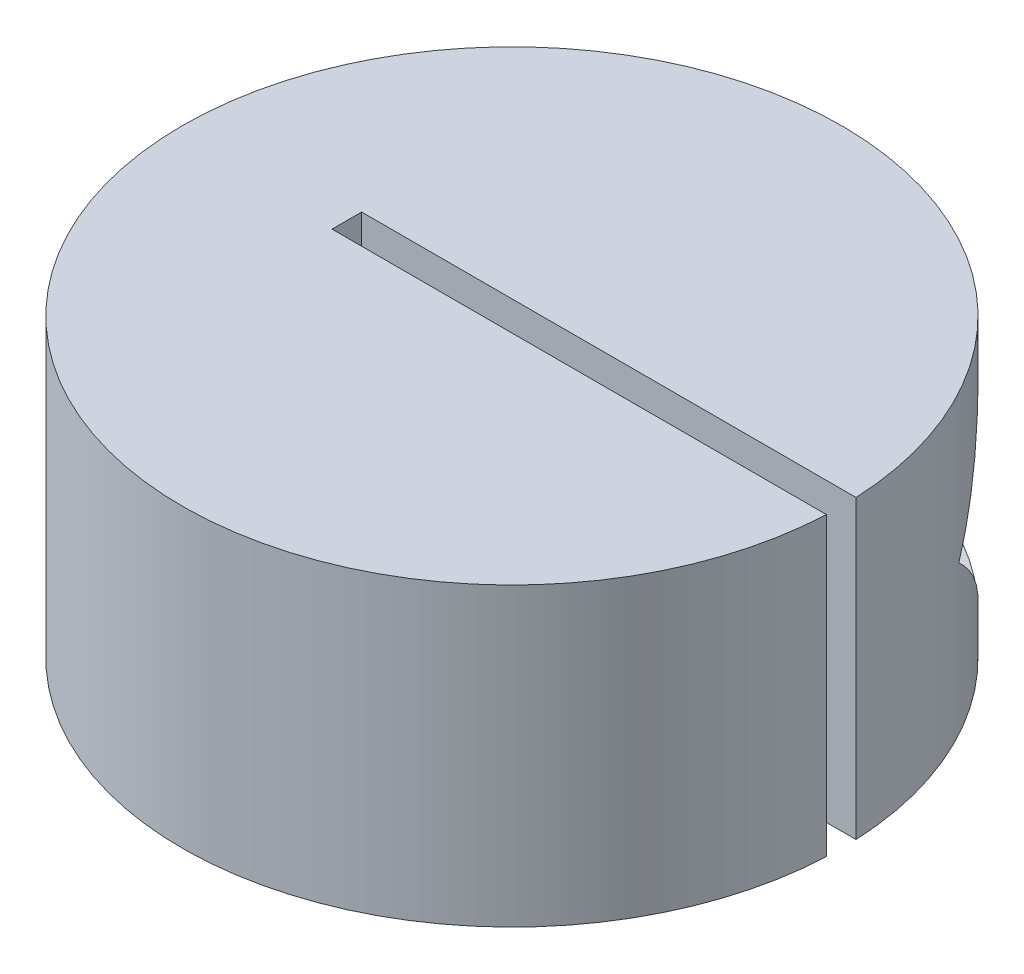
from build123d import *

# Parameters (mm, degrees)
SKETCH1_R           = 11.125
BOSS_EXTRUDE1_DEPTH = 10
CUT_EXTRUDE1_DEPTH  = 19.642190054
SKETCH3_W           = 17
SKETCH3_H           = 1
CUT_EXTRUDE2_DEPTH  = 19.642190054


with BuildPart() as part:
    # Sketch1 → Boss-Extrude1 (new body)
    with BuildSketch(Plane(origin=(0, 0, 0), x_dir=(1, 0, 0), z_dir=(0, 1, 0))):
        with Locations(Location((0, 0, 0), (0, 0, 270))):
            Circle(SKETCH1_R)
    extrude(amount=BOSS_EXTRUDE1_DEPTH)

    # Sketch2 → Cut-Extrude1 (cut, through all)
    with BuildSketch(Plane.XY):
        Polygon((3.469154423, 1.341962599), (7.683780529, 1.358090851), (9.777126106, 5.016128252), (7.655845577, 8.658037401), (3.441219471, 8.641909149), (1.347873894, 4.983871748), align=None)
    extrude(amount=-CUT_EXTRUDE1_DEPTH, mode=Mode.SUBTRACT)

    # Sketch3 → Cut-Extrude2 (cut, through all)
    with BuildSketch(Plane(origin=(0, 0, 0), x_dir=(1, 0, 0), z_dir=(0, 1, 0))):
        with Locations((2.926474536, 0)):
            Rectangle(SKETCH3_W, SKETCH3_H)
    extrude(amount=CUT_EXTRUDE2_DEPTH, mode=Mode.SUBTRACT)


solid = part.part
